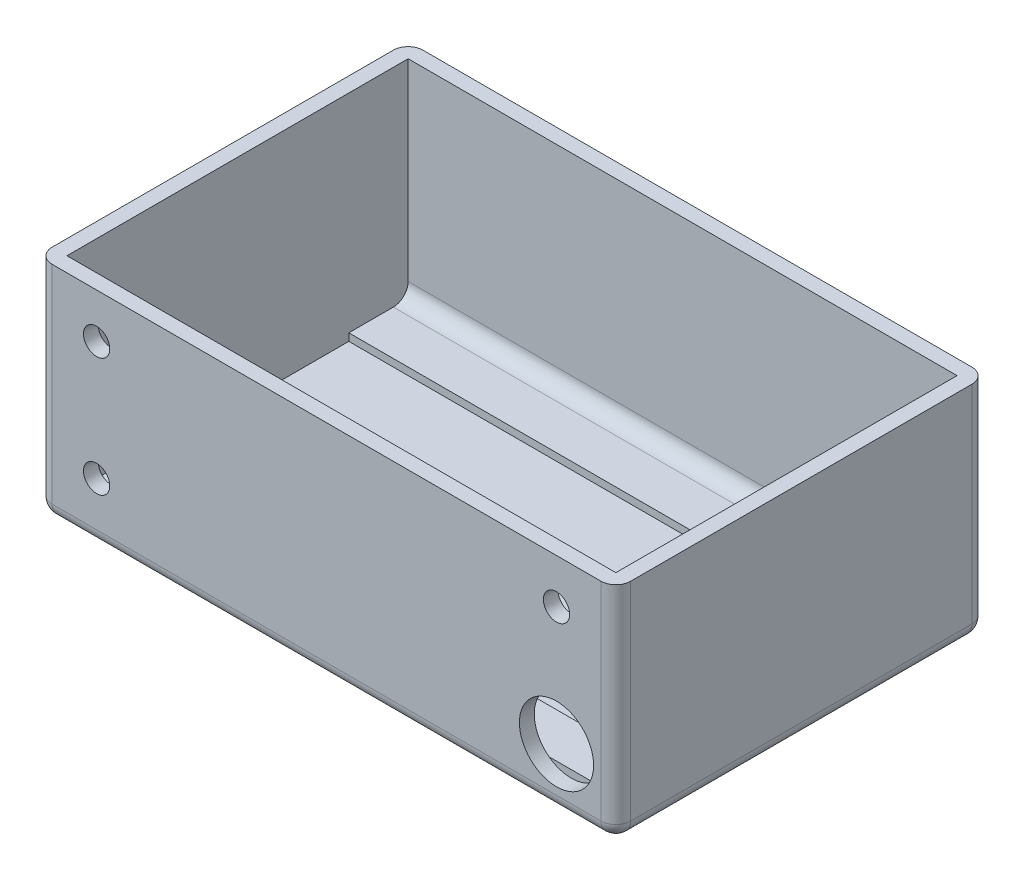
from build123d import *

# Parameters (mm, degrees)
BOSS_EXTRUDE1_DEPTH      = 48.26
FILLET1_R                = 2.5399999999999996
BOSS_EXTRUDE2_START      = -48.26
BOSS_EXTRUDE2_DEPTH      = 2.5399999999999996
BOSS_EXTRUDE3_START      = 48.26
BOSS_EXTRUDE3_DEPTH      = 2.5399999999999996
CUT_EXTRUDE2_START       = 29.21
SKETCH4_R                = 6.349999999999995
CUT_EXTRUDE2_DEPTH       = 2.54
FILLET2_R                = 2.5399999999999996
M4_CLEARANCE_HOLE1_D     = 4.5
M4_CLEARANCE_HOLE1_DEPTH = 2.54


with BuildPart() as part:
    # Sketch1 → Boss-Extrude1 (new, symmetric)
    with BuildSketch(Plane(origin=(0, 0, 0), x_dir=(0, 0, -1), z_dir=(1, 0, 0))):
        Polygon((31.75, -7.8e-16), (-31.75, -8.55e-15), (-31.75, 38.099999999999994), (-29.21, 38.099999999999994), (-29.209999999999997, 2.539999999999993), (-19.049999999999997, 2.539999999999993), (-19.049999999999997, 1.2699999999999922), (-6.350000000000001, 1.2699999999999922), (-6.35, 2.5399999999999943), (6.35, 2.539999999999996), (6.350000000000001, 1.2699999999999938), (19.049999999999997, 1.2699999999999971), (19.049999999999997, 2.5399999999999974), (29.209999999999997, 2.5399999999999996), (29.209999999999994, 38.1), (31.749999999999986, 38.1), align=None)
    extrude(amount=BOSS_EXTRUDE1_DEPTH, both=True)

    # Fillet1
    fillet1_edges = [part.edges().sort_by_distance(p)[0] for p in [
        (0, -8.55e-15, 31.75),
        (0, -7.8e-16, -31.75),
        (0, 2.5399999999999996, -29.209999999999997),
        (0, 2.539999999999993, 29.209999999999997),
    ]]
    fillet(fillet1_edges, radius=FILLET1_R)

    # Sketch3 → Boss-Extrude2 (add)
    with BuildSketch(Plane(origin=(0, 0, 0), x_dir=(0, 0, -1), z_dir=(1, 0, 0)).offset(BOSS_EXTRUDE2_START)):
        with BuildLine():
            Line((0, 38.099999999999994), (-31.75, 38.099999999999994))
            Line((-31.75, 38.099999999999994), (-31.75, 2.539999999999992))
            ThreePointArc((-31.75, 2.5399999999999934), (-31.00605122421383, 0.7439487757861607), (-29.209999999999997, -7.55e-15))
            Line((-29.209999999999997, -7.81e-15), (0, -4.23e-15))
            Line((0, 0), (1.56e-15, 38.099999999999994))
        make_face()
        with BuildLine():
            Line((31.75, 38.1), (0, 38.099999999999994))
            Line((1.56e-15, 38.099999999999994), (0, 0))
            Line((0, -4.23e-15), (29.210000000000004, -6.5e-16))
            ThreePointArc((29.210000000000004, -2.22e-15), (31.00605122421384, 0.7439487757861647), (31.750000000000014, 2.540000000000001))
            Line((31.750000000000014, 2.539999999999999), (31.75, 38.1))
        make_face()
    extrude(amount=BOSS_EXTRUDE2_DEPTH)

    # Sketch3<3> → Boss-Extrude3 (add)
    with BuildSketch(Plane(origin=(0, 0, 0), x_dir=(0, 0, -1), z_dir=(1, 0, 0)).offset(BOSS_EXTRUDE3_START)):
        with BuildLine():
            Line((31.75, 38.1), (0, 38.099999999999994))
            Line((1.56e-15, 38.099999999999994), (0, 0))
            Line((0, -4.23e-15), (29.210000000000004, -6.5e-16))
            ThreePointArc((29.210000000000004, -2.22e-15), (31.00605122421384, 0.7439487757861647), (31.750000000000014, 2.540000000000001))
            Line((31.750000000000014, 2.539999999999999), (31.75, 38.1))
        make_face()
        with BuildLine():
            Line((0, 38.099999999999994), (-31.75, 38.099999999999994))
            Line((-31.75, 38.099999999999994), (-31.75, 2.539999999999992))
            ThreePointArc((-31.75, 2.5399999999999934), (-31.00605122421383, 0.7439487757861607), (-29.209999999999997, -7.55e-15))
            Line((-29.209999999999997, -7.81e-15), (0, -4.23e-15))
            Line((0, 0), (1.56e-15, 38.099999999999994))
        make_face()
    extrude(amount=BOSS_EXTRUDE3_DEPTH)

    # Sketch4 → Cut-Extrude2 (cut)
    with BuildSketch(Plane.XY.offset(CUT_EXTRUDE2_START)):
        with Locations(Location((40.63999999999999, 10.159999999999991, 0), (0, 0, 233.130102354))):
            Circle(SKETCH4_R)
    extrude(amount=CUT_EXTRUDE2_DEPTH, mode=Mode.SUBTRACT)

    # Fillet2
    fillet2_edges = [part.edges().sort_by_distance(p)[0] for p in [
        (50.8, 20.319999999999993, 31.75),
        (50.8, 0.7439487757861605, 31.00605122421383),
        (50.8, -4.78e-15, -3.55e-15),
        (50.8, 0.7439487757861649, -31.00605122421384),
        (50.8, 20.32, -31.750000000000007),
        (-48.26, 20.32, -31.749999999999993),
        (-48.26, -4.67e-15, 0),
        (-48.26, 20.319999999999993, 31.75),
        (-48.26, 0.7439487757861611, 31.00605122421383),
        (-48.26, 0.7439487757861682, -31.00605122421383),
    ]]
    fillet(fillet2_edges, radius=FILLET2_R)

    # M4 Clearance Hole1
    with Locations(Plane(origin=(0, -2.85e-15, 29.209999999999997), x_dir=(-1, 0, 0), z_dir=(0, 7e-17, -1))):
        with Locations((-40.64, 30.48), (38.1, 30.48), (38.1, 10.16)):
            Hole(M4_CLEARANCE_HOLE1_D / 2, depth=M4_CLEARANCE_HOLE1_DEPTH)


solid = part.part
